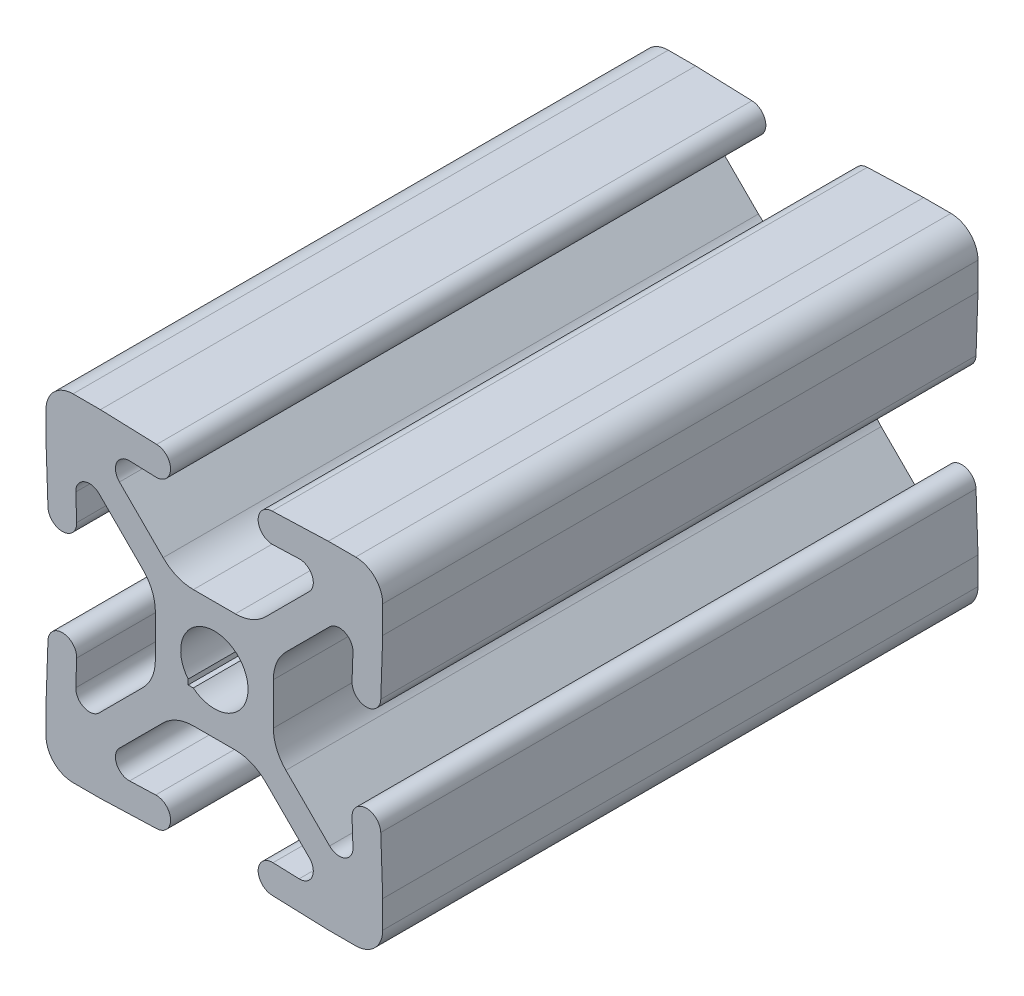
from build123d import *

# Parameters (mm, degrees)
BOSS_EXTRUDE1_DEPTH = 44.196


with BuildPart() as part:
    # Model → Boss-Extrude1 (new body)
    with BuildSketch(Plane.XY):
        with BuildLine():
            Line((50.659960212, 72.999871414), (53.774553856, 72.999871414))
            ThreePointArc((53.774553856, 72.999871414), (54.989573754, 72.758188929), (56.019617887, 72.069935444))
            Line((56.019617887, 72.069935444), (59.264200891, 68.825352439))
            ThreePointArc((59.264200891, 68.825352439), (59.477513437, 67.701802895), (58.510322513, 67.091550869))
            Line((58.510322513, 67.091550869), (56.572487817, 67.159221548))
            ThreePointArc((56.572487817, 67.159221548), (55.4691069, 66.130302197), (56.498026251, 65.026921279))
            Line((56.498026251, 65.026921279), (60.677257034, 64.880979325))
            Line((60.677257034, 64.880979325), (62.710657034, 64.880979325))
            ThreePointArc((62.710657034, 64.880979325), (64.129537501, 65.468698857), (64.717257034, 66.887579325))
            Line((64.717257034, 66.887579325), (64.717257034, 68.920979325))
            Line((64.717257034, 68.920979325), (64.57131508, 73.100210108))
            ThreePointArc((64.57131508, 73.100210108), (63.467934162, 74.129129459), (62.439014811, 73.025748542))
            Line((62.439014811, 73.025748542), (62.50668549, 71.087913846))
            ThreePointArc((62.50668549, 71.087913846), (61.896433464, 70.120722922), (60.77288392, 70.334035468))
            Line((60.77288392, 70.334035468), (57.528300915, 73.578618472))
            ThreePointArc((57.528300915, 73.578618472), (56.84004743, 74.608662605), (56.598364945, 75.823682503))
            Line((56.598364945, 75.823682503), (56.598364945, 78.938276147))
            ThreePointArc((56.598364945, 78.938276147), (56.84004743, 80.153296044), (57.528300915, 81.183340177))
            Line((57.528300915, 81.183340177), (60.77288392, 84.427923182))
            ThreePointArc((60.77288392, 84.427923182), (61.896433464, 84.641235728), (62.50668549, 83.674044803))
            Line((62.50668549, 83.674044803), (62.439014811, 81.736210108))
            ThreePointArc((62.439014811, 81.736210108), (63.467934162, 80.63282919), (64.57131508, 81.661748542))
            Line((64.57131508, 81.661748542), (64.717257034, 85.840979325))
            Line((64.717257034, 85.840979325), (64.717257034, 87.874379325))
            ThreePointArc((64.717257034, 87.874379325), (64.129537501, 89.293259792), (62.710657034, 89.880979325))
            Line((62.710657034, 89.880979325), (60.677257034, 89.880979325))
            Line((60.677257034, 89.880979325), (56.498026251, 89.73503737))
            ThreePointArc((56.498026251, 89.73503737), (55.4691069, 88.631656452), (56.572487817, 87.602737101))
            Line((56.572487817, 87.602737101), (58.510322513, 87.67040778))
            ThreePointArc((58.510322513, 87.67040778), (59.477513437, 87.060155754), (59.264200891, 85.93660621))
            Line((59.264200891, 85.93660621), (56.019617887, 82.692023205))
            ThreePointArc((56.019617887, 82.692023205), (54.989573754, 82.00376972), (53.774553856, 81.762087236))
            Line((53.774553856, 81.762087236), (50.659960212, 81.762087236))
            ThreePointArc((50.659960212, 81.762087236), (49.444940315, 82.00376972), (48.414896182, 82.692023205))
            Line((48.414896182, 82.692023205), (45.170313177, 85.93660621))
            ThreePointArc((45.170313177, 85.93660621), (44.957000631, 87.060155754), (45.924191556, 87.67040778))
            Line((45.924191556, 87.67040778), (47.862026251, 87.602737101))
            ThreePointArc((47.862026251, 87.602737101), (48.965407169, 88.631656452), (47.936487817, 89.73503737))
            Line((47.936487817, 89.73503737), (43.757257034, 89.880979325))
            Line((43.757257034, 89.880979325), (41.723857034, 89.880979325))
            ThreePointArc((41.723857034, 89.880979325), (40.304976567, 89.293259792), (39.717257034, 87.874379325))
            Line((39.717257034, 87.874379325), (39.717257034, 85.840979325))
            Line((39.717257034, 85.840979325), (39.863198989, 81.661748542))
            ThreePointArc((39.863198989, 81.661748542), (40.966579907, 80.63282919), (41.995499258, 81.736210108))
            Line((41.995499258, 81.736210108), (41.927828579, 83.674044803))
            ThreePointArc((41.927828579, 83.674044803), (42.538080605, 84.641235728), (43.661630149, 84.427923182))
            Line((43.661630149, 84.427923182), (46.906213154, 81.183340177))
            ThreePointArc((46.906213154, 81.183340177), (47.594466639, 80.153296044), (47.836149123, 78.938276147))
            Line((47.836149123, 78.938276147), (47.836149123, 75.823682503))
            ThreePointArc((47.836149123, 75.823682503), (47.594466639, 74.608662605), (46.906213154, 73.578618472))
            Line((46.906213154, 73.578618472), (43.661630149, 70.334035468))
            ThreePointArc((43.661630149, 70.334035468), (42.538080605, 70.120722922), (41.927828579, 71.087913846))
            Line((41.927828579, 71.087913846), (41.995499258, 73.025748542))
            ThreePointArc((41.995499258, 73.025748542), (40.966579907, 74.129129459), (39.863198989, 73.100210108))
            Line((39.863198989, 73.100210108), (39.717257034, 68.920979325))
            Line((39.717257034, 68.920979325), (39.717257034, 66.887579325))
            ThreePointArc((39.717257034, 66.887579325), (40.304976567, 65.468698857), (41.723857034, 64.880979325))
            Line((41.723857034, 64.880979325), (43.757257034, 64.880979325))
            Line((43.757257034, 64.880979325), (47.936487817, 65.026921279))
            ThreePointArc((47.936487817, 65.026921279), (48.965407169, 66.130302197), (47.862026251, 67.159221548))
            Line((47.862026251, 67.159221548), (45.924191556, 67.091550869))
            ThreePointArc((45.924191556, 67.091550869), (44.957000631, 67.701802895), (45.170313177, 68.825352439))
            Line((45.170313177, 68.825352439), (48.414896182, 72.069935444))
            ThreePointArc((48.414896182, 72.069935444), (49.444940315, 72.758188929), (50.659960212, 72.999871414))
        make_face()
        with BuildLine():
            Line((50.64953831, 75.433607249), (50.269884959, 75.433607249))
            Line((50.269884959, 75.433607249), (50.269884959, 75.8132606))
            ThreePointArc((50.269884959, 75.8132606), (53.985023987, 79.148746278), (50.64953831, 75.433607249))
        make_face(mode=Mode.SUBTRACT)
    extrude(amount=BOSS_EXTRUDE1_DEPTH)


solid = part.part
